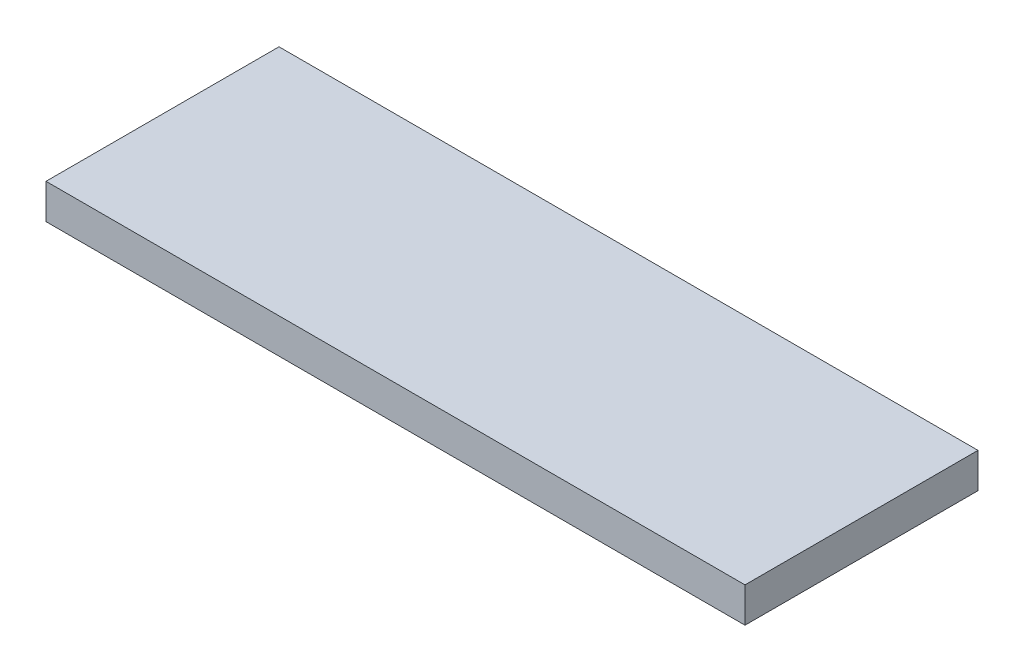
from build123d import *

# Parameters (mm, degrees)
SKETCH1_W           = 60
SKETCH1_H           = 20
BOSS_EXTRUDE1_DEPTH = 3


with BuildPart() as part:
    # Sketch1 → Boss-Extrude1 (new body)
    with BuildSketch(Plane(origin=(0, 0, 0), x_dir=(1, 0, 0), z_dir=(0, 1, 0))):
        with Locations((30, 10)):
            Rectangle(SKETCH1_W, SKETCH1_H)
    extrude(amount=BOSS_EXTRUDE1_DEPTH)


solid = part.part
